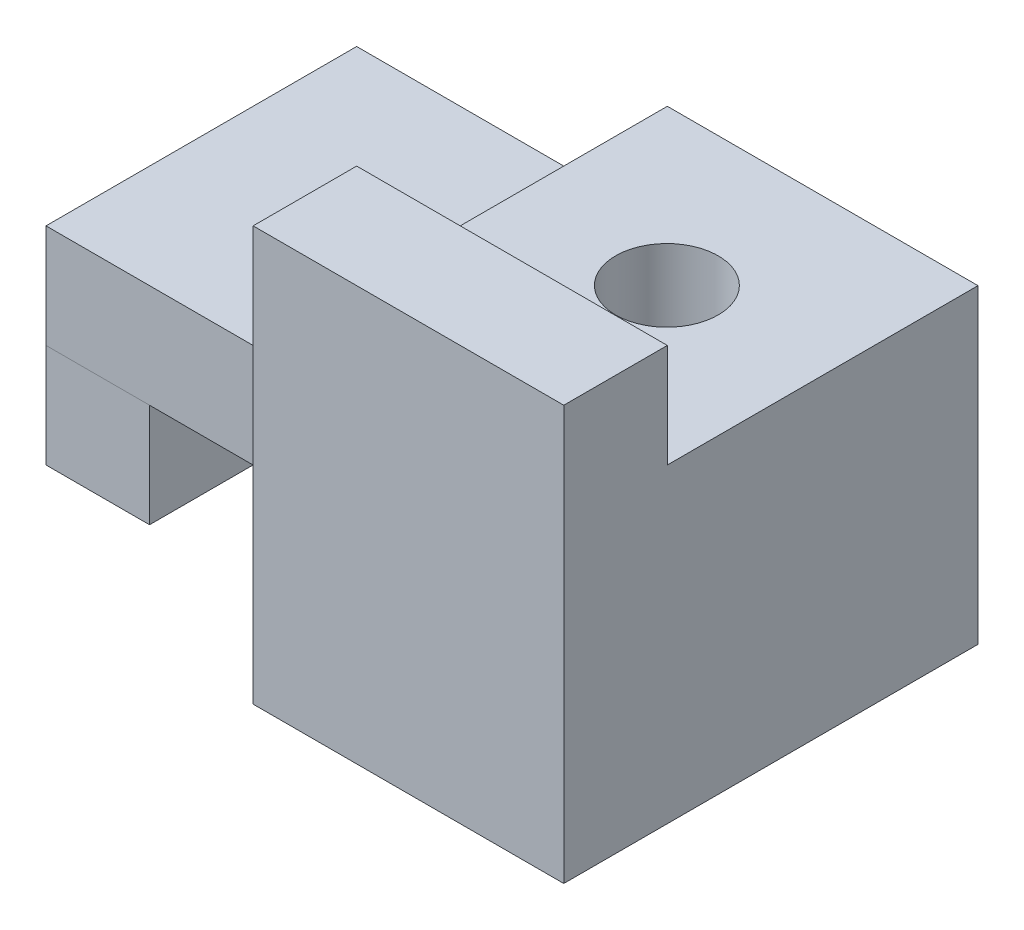
from build123d import *

# Parameters (mm, degrees)
SKETCH1_W                = 76.2
SKETCH1_H                = 76.2
BOSS_EXTRUDE1_DEPTH      = 25.4
BOSS_EXTRUDE2_DEPTH      = 25.4
BOSS_EXTRUDE2_DEPTH_BACK = 25.4
SKETCH2_W                = 76.2
SKETCH2_H                = 101.6
SKETCH3_W                = 25.4
SKETCH3_H                = 76.2
BOSS_EXTRUDE3_DEPTH      = 25.4
SKETCH4_W                = 76.2
SKETCH4_H                = 25.4
BOSS_EXTRUDE4_DEPTH      = 25.4
SKETCH5_W                = 76.2
SKETCH5_H                = 101.6
BOSS_EXTRUDE5_DEPTH      = 25.4
SKETCH7_R                = 12.577647636
CUT_EXTRUDE1_DEPTH       = 76.2
SKETCH6_R                = 12.762668173
CUT_EXTRUDE2_DEPTH       = 25.4


with BuildPart() as part:
    # Sketch1 → Boss-Extrude1 (new body)
    with BuildSketch(Plane(origin=(0, 0, 0), x_dir=(1, 0, 0), z_dir=(0, 1, 0))):
        with Locations((38.1, 38.1)):
            Rectangle(SKETCH1_W, SKETCH1_H)
    extrude(amount=BOSS_EXTRUDE1_DEPTH)

    # Sketch2 → Boss-Extrude2 (add, two sides: drawn at the far end of the back side and taken through both)
    with BuildSketch(Plane(origin=(0, 25.4, 0), x_dir=(1, 0, 0), z_dir=(0, 1, 0)).offset(-BOSS_EXTRUDE2_DEPTH_BACK)):
        with Locations((114.3, 25.4)):
            Rectangle(SKETCH2_W, SKETCH2_H)
    extrude(amount=BOSS_EXTRUDE2_DEPTH + BOSS_EXTRUDE2_DEPTH_BACK)

    # Sketch4 → Boss-Extrude4 (add)
    with BuildSketch(Plane(origin=(0, 50.8, 0), x_dir=(1, 0, 0), z_dir=(0, 1, 0))):
        with Locations((114.3, -12.7)):
            Rectangle(SKETCH4_W, SKETCH4_H)
    extrude(amount=BOSS_EXTRUDE4_DEPTH)

    # Sketch5 → Boss-Extrude5 (add)
    with BuildSketch(Plane.XZ):
        with Locations((114.3, -25.4)):
            Rectangle(SKETCH5_W, SKETCH5_H)
    extrude(amount=BOSS_EXTRUDE5_DEPTH)

    # Sketch7 → Cut-Extrude1 (cut)
    with BuildSketch(Plane(origin=(0, 50.8, 0), x_dir=(1, 0, 0), z_dir=(0, 1, 0))):
        with Locations((114.191992331, 38.1)):
            Circle(SKETCH7_R)
    extrude(amount=-CUT_EXTRUDE1_DEPTH, mode=Mode.SUBTRACT)

    # Sketch6 → Cut-Extrude2 (cut)
    with BuildSketch(Plane(origin=(0, 25.4, 0), x_dir=(1, 0, 0), z_dir=(0, 1, 0))):
        with Locations((50.817418917, 37.991957485)):
            Circle(SKETCH6_R)
    extrude(amount=-CUT_EXTRUDE2_DEPTH, mode=Mode.SUBTRACT)


with BuildPart() as body_2:
    # Sketch3 → Boss-Extrude3 (new body)
    with BuildSketch(Plane.XZ):
        with Locations((12.7, -38.1)):
            Rectangle(SKETCH3_W, SKETCH3_H)
    extrude(amount=BOSS_EXTRUDE3_DEPTH)


solid = Compound([part.part, body_2.part])
